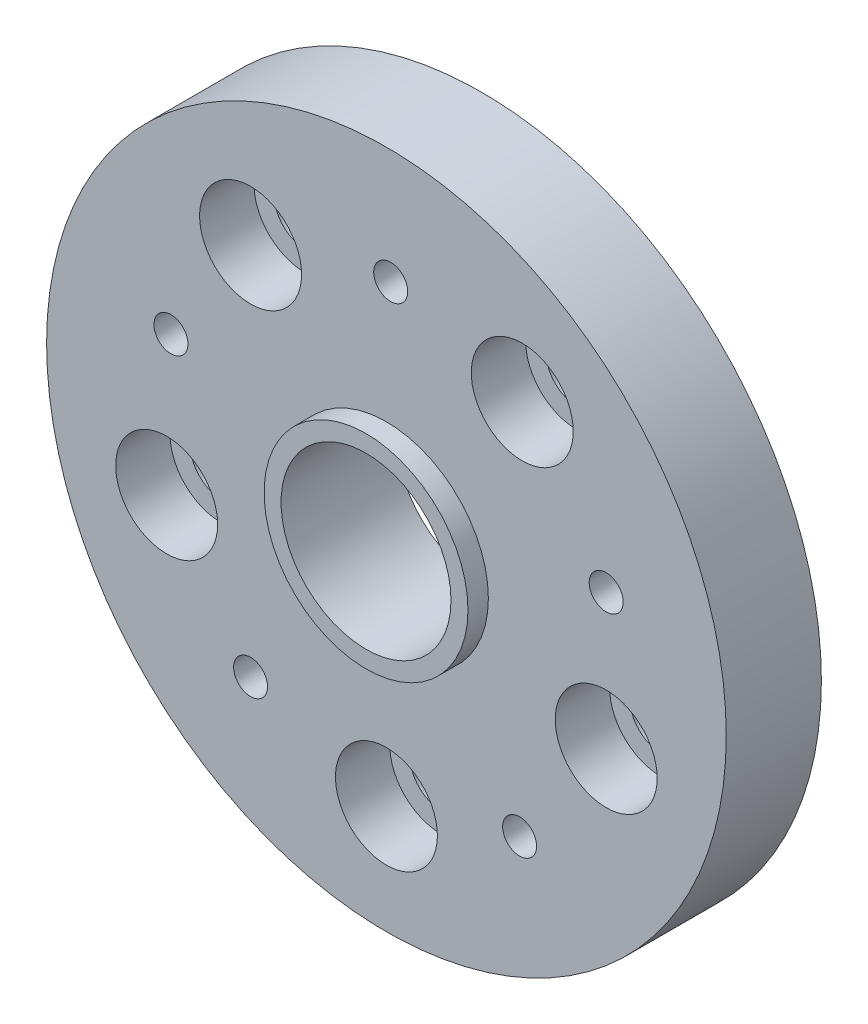
from build123d import *

# Parameters (mm, degrees)
SKETCH1_R                      = 50
BOSS_EXTRUDE1_DEPTH            = 14
SKETCH2_R                      = 12.5
CUT_EXTRUDE1_DEPTH             = 73.083285164
BOSS_EXTRUDE2_START            = 3
SKETCH3_R                      = 15
SKETCH3_R_2                    = 12.5
BOSS_EXTRUDE2_DEPTH            = 3
CBORE_FOR_M8_SHCS1_D           = 9
CBORE_FOR_M8_SHCS1_CBORE_D     = 15
CBORE_FOR_M8_SHCS1_CBORE_DEPTH = 8
M6X1_0_TAPPED_HOLE1_D          = 5


with BuildPart() as part:
    # Sketch1 → Boss-Extrude1 (new body)
    with BuildSketch(Plane.XY):
        Circle(SKETCH1_R)
    extrude(amount=BOSS_EXTRUDE1_DEPTH)

    # Sketch2 → Cut-Extrude1 (cut, through all)
    with BuildSketch(Plane.XY.offset(14)):
        Circle(SKETCH2_R)
    extrude(amount=-CUT_EXTRUDE1_DEPTH, mode=Mode.SUBTRACT)

    # Sketch3 → Boss-Extrude2 (add)
    with BuildSketch(Plane.XY.offset(14).offset(BOSS_EXTRUDE2_START)):
        Circle(SKETCH3_R)
        Circle(SKETCH3_R_2, mode=Mode.SUBTRACT)
    extrude(amount=-BOSS_EXTRUDE2_DEPTH)

    # CBORE for M8 SHCS1 (through all)
    with Locations(Plane.XY.offset(14)):
        with Locations((0, -34), (-32.335921554, -10.506577809), (-19.984698578, 27.506577809), (19.984698578, 27.506577809), (32.335921554, -10.506577809)):
            CounterBoreHole(CBORE_FOR_M8_SHCS1_D / 2, CBORE_FOR_M8_SHCS1_CBORE_D / 2, CBORE_FOR_M8_SHCS1_CBORE_DEPTH)

    # M6x1.0 Tapped Hole1 (through all)
    with Locations(Plane.XY.offset(14)):
        with Locations((-19.984698578, -27.506577809), (-31.705846612, 10.30185405), (0.630074942, 33.132776241), (32.335921554, 9.434630291), (19.595290848, -28.042551568), (0.174148431, -0.535973759)):
            Hole(M6X1_0_TAPPED_HOLE1_D / 2)


solid = part.part
